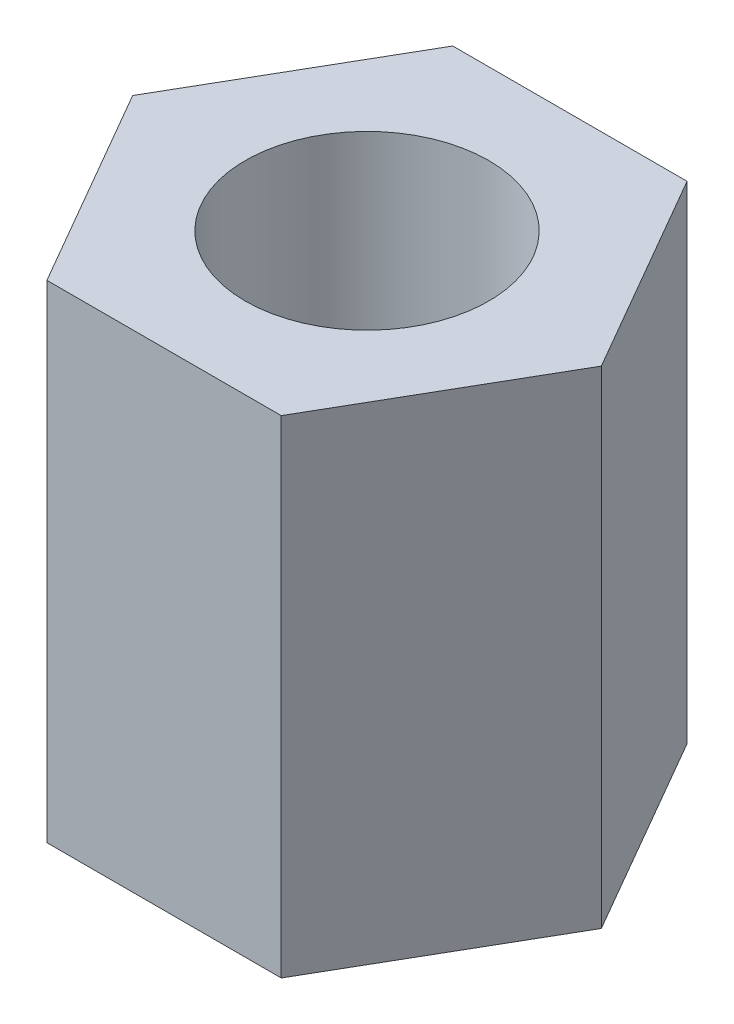
from build123d import *

# Parameters (mm, degrees)
CROQUIS1_R              = 1.5
SALIENTE_EXTRUIR1_DEPTH = 6


with BuildPart() as part:
    # Croquis1 → Saliente-Extruir1 (new body)
    with BuildSketch(Plane(origin=(0, 0, 0), x_dir=(1, 0, 0), z_dir=(0, 1, 0))):
        Polygon((1.443375673, -2.5), (2.886751346, 0), (1.443375673, 2.5), (-1.443375673, 2.5), (-2.886751346, 0), (-1.443375673, -2.5), align=None)
        with Locations(Location((0, 0, 0), (0, 0, 270))):
            Circle(CROQUIS1_R, mode=Mode.SUBTRACT)
    extrude(amount=SALIENTE_EXTRUIR1_DEPTH)


solid = part.part
